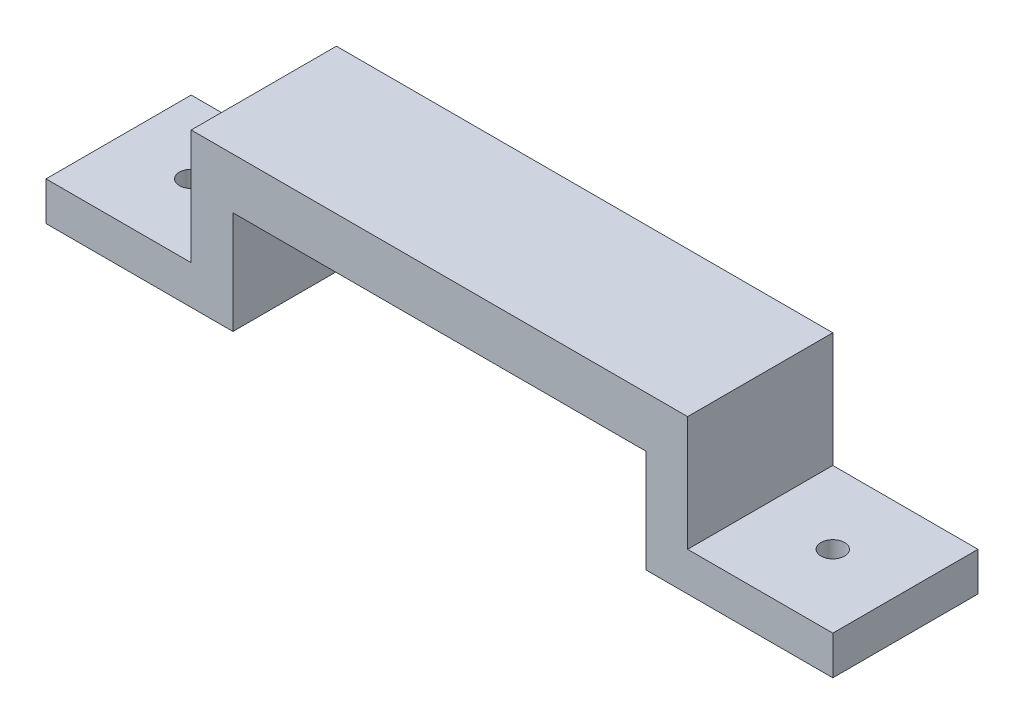
from build123d import *

# Parameters (mm, degrees)
EXTRUDE_1_DEPTH = 16
SKETCH_3_W      = 16
SKETCH_3_H      = 4.26667426
EXTRUDE_3_DEPTH = 16
SKETCH_23_W     = 16
SKETCH_23_H     = 4.26667426
EXTRUDE_4_DEPTH = 16
F_2_0MM_2_D     = 2.6
F_2_0MM_3_D     = 2.6
SKETCH_33_W     = 45.5
SKETCH_33_H     = 16
EXTRUDE_5_DEPTH = 1


with BuildPart() as part:
    # 草图2 → 凸台-拉伸1 (new body)
    with BuildSketch(Plane.XY):
        Polygon((34.591799544, 12.66332574), (-20.108200456, 12.66332574), (-20.108200456, -4.26667426), (-15.508200456, -4.26667426), (-15.508200456, 8.06332574), (29.991799544, 8.06332574), (29.991799544, -4.26667426), (34.591799544, -4.26667426), align=None)
    extrude(amount=EXTRUDE_1_DEPTH)

    # 草图3 → 凸台-拉伸3 (add)
    with BuildSketch(Plane.ZY.offset(20.108200456)):
        with Locations((8, -2.13333713)):
            Rectangle(SKETCH_3_W, SKETCH_3_H)
    extrude(amount=EXTRUDE_3_DEPTH)

    # 草图23 → 凸台-拉伸4 (add)
    with BuildSketch(Plane(origin=(34.591799544, 0, 0), x_dir=(0, 0, -1), z_dir=(1, 0, 0))):
        with Locations((-8, -2.13333713)):
            Rectangle(SKETCH_23_W, SKETCH_23_H)
    extrude(amount=EXTRUDE_4_DEPTH)

    # Ø2.0mm 暗销孔2 (through all)
    with Locations(Plane(origin=(0, 0, 0), x_dir=(1, 0, 0), z_dir=(0, 1, 0))):
        with Locations((42.591799544, -8)):
            Hole(F_2_0MM_2_D / 2)

    # Ø2.0mm 暗销孔3 (through all)
    with Locations(Plane(origin=(0, 0, 0), x_dir=(1, 0, 0), z_dir=(0, 1, 0))):
        with Locations((-28.108200456, -8)):
            Hole(F_2_0MM_3_D / 2)

    # 草图33 → 凸台-拉伸5 (add)
    with BuildSketch(Plane.XZ.offset(-8.06332574)):
        with Locations((7.241799544, 8)):
            Rectangle(SKETCH_33_W, SKETCH_33_H)
    extrude(amount=EXTRUDE_5_DEPTH)


solid = part.part
